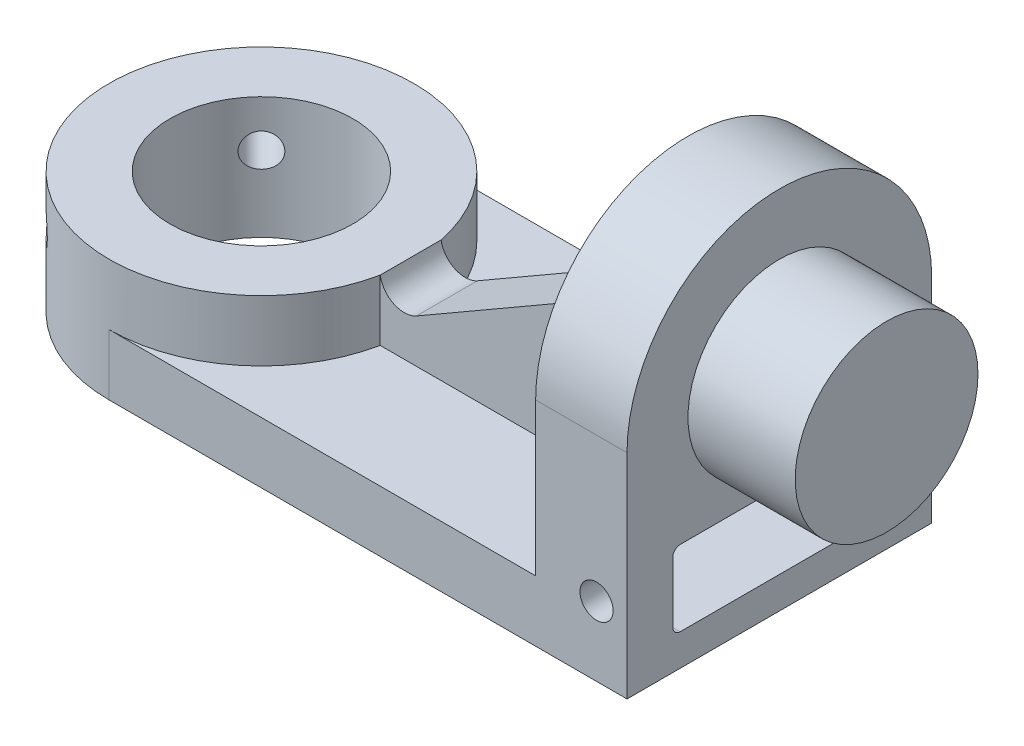
from build123d import *

# Parameters (mm, degrees)
BOSS_EXTRUDE1_DEPTH = 6.35
SKETCH1_3_R         = 9.525
BOSS_EXTRUDE2_DEPTH = 12.7
BOSS_EXTRUDE3_DEPTH = 31.75
CUT_EXTRUDE1_REACH  = 70.759
SKETCH4_R           = 9.525
BOSS_EXTRUDE4_DEPTH = 11.176
CUT_EXTRUDE5_DEPTH  = 11.176
CUT_EXTRUDE6_DEPTH  = 8.001
SKETCH6_R           = 1.7272
CUT_EXTRUDE7_DEPTH  = 8.001
SKETCH7_R           = 1.7272
CUT_EXTRUDE8_DEPTH  = 8.001
SKETCH8_R           = 1.7272
CUT_EXTRUDE9_DEPTH  = 32.131


with BuildPart() as part:
    # Sketch1 → Boss-Extrude1 (new body)
    with BuildSketch(Plane(origin=(0, 0, 0), x_dir=(1, 0, 0), z_dir=(0, 1, 0))):
        with BuildLine():
            ThreePointArc((15.875, 15.875), (11.225320151, 4.649679849), (0, 0))
            Line((0, 0), (53.975, 0))
            Line((53.975, 0), (53.975, 31.75))
            Line((53.975, 31.75), (0, 31.75))
            ThreePointArc((0, 31.75), (11.225320151, 27.100320151), (15.875, 15.875))
        make_face()
    extrude(amount=BOSS_EXTRUDE1_DEPTH)

    # Sketch1<3> → Boss-Extrude2 (add)
    with BuildSketch(Plane(origin=(0, 0, 0), x_dir=(1, 0, 0), z_dir=(0, 1, 0))):
        with BuildLine():
            ThreePointArc((0, 31.75), (-15.875, 15.875), (0, 0))
            ThreePointArc((0, 0), (11.225320151, 4.649679849), (15.875, 15.875))
            ThreePointArc((15.875, 15.875), (11.225320151, 27.100320151), (0, 31.75))
        make_face()
        with Locations((0, 15.875)):
            Circle(SKETCH1_3_R, mode=Mode.SUBTRACT)
    extrude(amount=BOSS_EXTRUDE2_DEPTH)

    # Sketch2 → Boss-Extrude3 (add)
    with BuildSketch(Plane(origin=(0, 6.35, 0), x_dir=(1, 0, 0), z_dir=(0, 1, 0))):
        with BuildLine():
            Line((44.45, 19.05), (15.554259867, 19.05))
            ThreePointArc((15.554259867, 19.05), (15.875, 15.875), (15.554259867, 12.7))
            Line((15.554259867, 12.7), (44.45, 12.7))
            Line((44.45, 12.7), (44.45, 0))
            Line((44.45, 0), (53.975, 0))
            Line((53.975, 0), (53.975, 31.75))
            Line((53.975, 31.75), (44.45, 31.75))
            Line((44.45, 31.75), (44.45, 19.05))
        make_face()
    extrude(amount=BOSS_EXTRUDE3_DEPTH)

    # Sketch3 → Cut-Extrude1 (cut, up to next)
    with BuildSketch(Plane.XY.offset(-12.7), mode=Mode.PRIVATE) as cut_extrude1_sk1:
        with BuildLine():
            Line((15.554259867, 38.1), (15.554259867, 12.7))
            ThreePointArc((15.554259867, 12.7), (16.969776393, 10.805527444), (19.332836073, 10.898598646))
            Line((19.332836073, 10.898598646), (44.45, 25.4))
            Line((44.45, 25.4), (44.45, 38.1))
            Line((44.45, 38.1), (15.554259867, 38.1))
        make_face()
    cut_extrude1_tool1 = extrude(cut_extrude1_sk1.sketch, amount=-CUT_EXTRUDE1_REACH, mode=Mode.PRIVATE) & part.part
    add(cut_extrude1_tool1.solids().sort_by_distance((28.175403, 27.146938, -12.7))[0], mode=Mode.SUBTRACT)

    # Sketch4<3> → Cut-Extrude5 (cut)
    with BuildSketch(Plane(origin=(53.975, 0, 0), x_dir=(0, 0, -1), z_dir=(1, 0, 0))):
        with BuildLine():
            ThreePointArc((0, 22.225), (15.875, 38.1), (31.75, 22.225))
            Line((31.75, 22.225), (36.075719822, 22.225))
            Line((36.075719822, 22.225), (36.075719822, 42.558697958))
            Line((36.075719822, 42.558697958), (-5.810634452, 42.558697958))
            Line((-5.810634452, 42.558697958), (-5.810634452, 22.225))
            Line((-5.810634452, 22.225), (0, 22.225))
        make_face()
    extrude(amount=-CUT_EXTRUDE5_DEPTH, mode=Mode.SUBTRACT)

    # Sketch4<4> → Cut-Extrude6 (cut)
    with BuildSketch(Plane(origin=(53.975, 0, 0), x_dir=(0, 0, -1), z_dir=(1, 0, 0))):
        with BuildLine():
            ThreePointArc((5.5372, 11.176), (4.998384633, 10.952815367), (4.7752, 10.414))
            Line((4.7752, 10.414), (4.7752, 4.064))
            ThreePointArc((4.7752, 4.064), (4.998384633, 3.525184633), (5.5372, 3.302))
            Line((5.5372, 3.302), (26.2128, 3.302))
            ThreePointArc((26.2128, 3.302), (26.751615367, 3.525184633), (26.9748, 4.064))
            Line((26.9748, 4.064), (26.9748, 10.414))
            ThreePointArc((26.9748, 10.414), (26.751615367, 10.952815367), (26.2128, 11.176))
            Line((26.2128, 11.176), (5.5372, 11.176))
        make_face()
    extrude(amount=-CUT_EXTRUDE6_DEPTH, mode=Mode.SUBTRACT)

    # Sketch6 → Cut-Extrude7 (cut)
    with BuildSketch(Plane(origin=(-19.162820151, 0, -19.162820151), x_dir=(-0.7071067811865487, 0, 0.7071067811865465), z_dir=(-0.7071067811865465, 0, -0.7071067811865487))):
        with Locations((-11.225320151, 7.874)):
            Circle(SKETCH6_R)
    extrude(amount=-CUT_EXTRUDE7_DEPTH, mode=Mode.SUBTRACT)

    # Sketch7 → Cut-Extrude8 (cut)
    with BuildSketch(Plane(origin=(-11.225320151, 12.7, -4.649679849), x_dir=(0.707106781186549, 0, 0.707106781186546), z_dir=(-0.707106781186546, 0, 0.707106781186549))):
        with Locations((0, -4.826)):
            Circle(SKETCH7_R)
    extrude(amount=-CUT_EXTRUDE8_DEPTH, mode=Mode.SUBTRACT)

    # Sketch8 → Cut-Extrude9 (cut)
    with BuildSketch(Plane.XY):
        with Locations((50.8, 7.239)):
            Circle(SKETCH8_R)
    extrude(amount=-CUT_EXTRUDE9_DEPTH, mode=Mode.SUBTRACT)


with BuildPart() as body_2:
    # Sketch4 → Boss-Extrude4 (new body)
    with BuildSketch(Plane(origin=(53.975, 0, 0), x_dir=(0, 0, -1), z_dir=(1, 0, 0))):
        with Locations((15.875, 22.225)):
            Circle(SKETCH4_R)
    extrude(amount=BOSS_EXTRUDE4_DEPTH)


solid = Compound([part.part, body_2.part])
